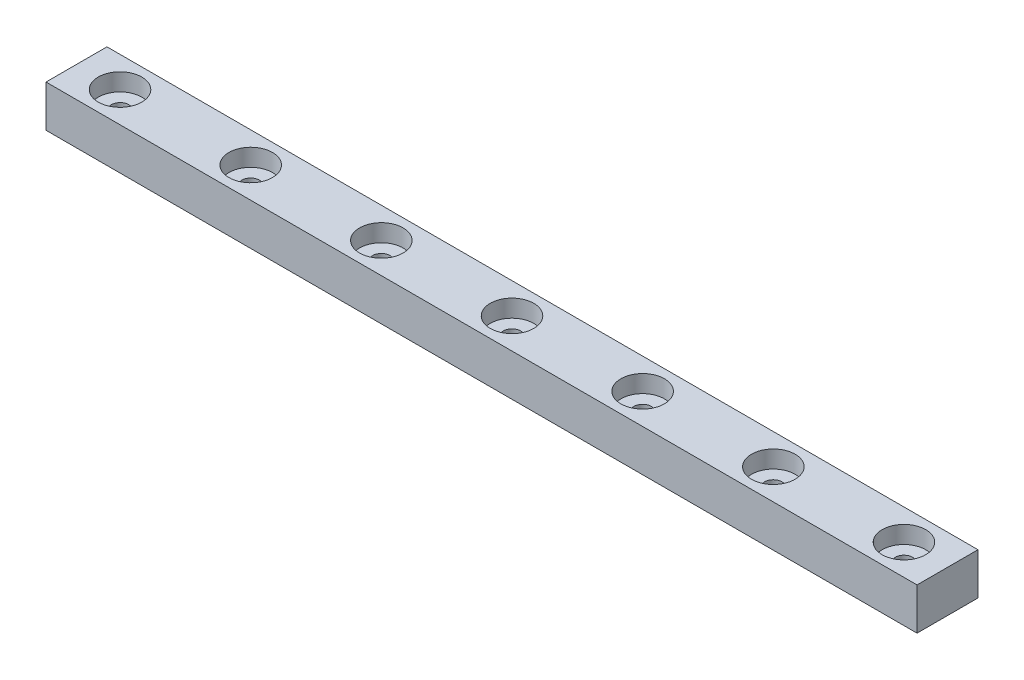
from build123d import *

# Parameters (mm, degrees)
SKETCH_1_W                     = 100
SKETCH_1_H                     = 7
EXTRUDE_1_DEPTH                = 4.8
HOLE_WIZARD_M1_6_1_D           = 2
HOLE_WIZARD_M1_6_1_CBORE_D     = 5
HOLE_WIZARD_M1_6_1_CBORE_DEPTH = 2


with BuildPart() as part:
    # 草图1 → 凸台-拉伸1 (new body)
    with BuildSketch(Plane(origin=(0, 4.8, 0), x_dir=(1, 0, 0), z_dir=(0, 1, 0))):
        Rectangle(SKETCH_1_W, SKETCH_1_H)
    extrude(amount=-EXTRUDE_1_DEPTH)

    # M1.6 凹头盖螺钉的柱形沉头孔1 (through all)
    with Locations(Plane(origin=(0, 4.8, 0), x_dir=(1, 0, 0), z_dir=(0, 1, 0))):
        with Locations((-30, 0), (-15, 0), (0, 0), (15, 0), (30, 0), (45, 0), (-45, 0)):
            CounterBoreHole(HOLE_WIZARD_M1_6_1_D / 2, HOLE_WIZARD_M1_6_1_CBORE_D / 2, HOLE_WIZARD_M1_6_1_CBORE_DEPTH)


solid = part.part
